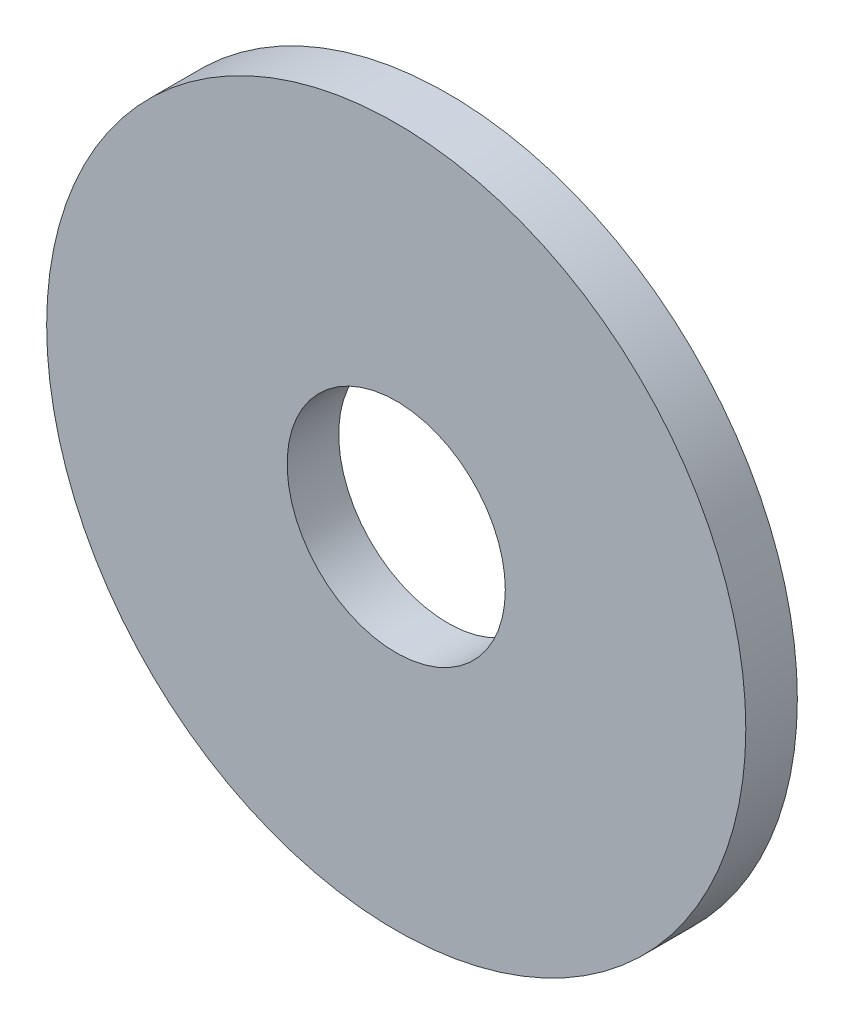
from build123d import *

# Parameters (mm, degrees)
SKETCH1_R           = 10.175
SKETCH1_R_2         = 3.175
BOSS_EXTRUDE1_DEPTH = 1.5


with BuildPart() as part:
    # Sketch1 → Boss-Extrude1 (new body)
    with BuildSketch(Plane.XY):
        with Locations((-5.065195061, 3.509456578)):
            Circle(SKETCH1_R)
        with Locations((-5.065195061, 3.509456578)):
            Circle(SKETCH1_R_2, mode=Mode.SUBTRACT)
    extrude(amount=BOSS_EXTRUDE1_DEPTH)


solid = part.part
